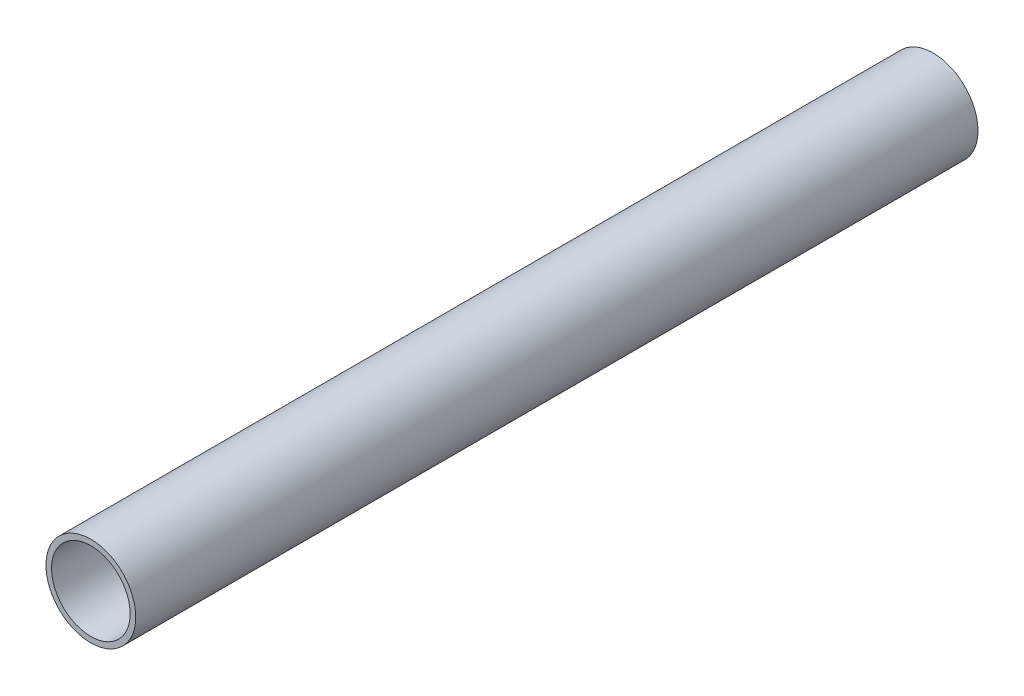
from build123d import *

# Parameters (mm, degrees)
SKETCH_1_R      = 8
SKETCH_1_R_2    = 7
EXTRUDE_1_DEPTH = 150


with BuildPart() as part:
    # 草图1 → 凸台-拉伸1 (new body)
    with BuildSketch(Plane.XY):
        Circle(SKETCH_1_R)
        Circle(SKETCH_1_R_2, mode=Mode.SUBTRACT)
    extrude(amount=EXTRUDE_1_DEPTH)


solid = part.part
